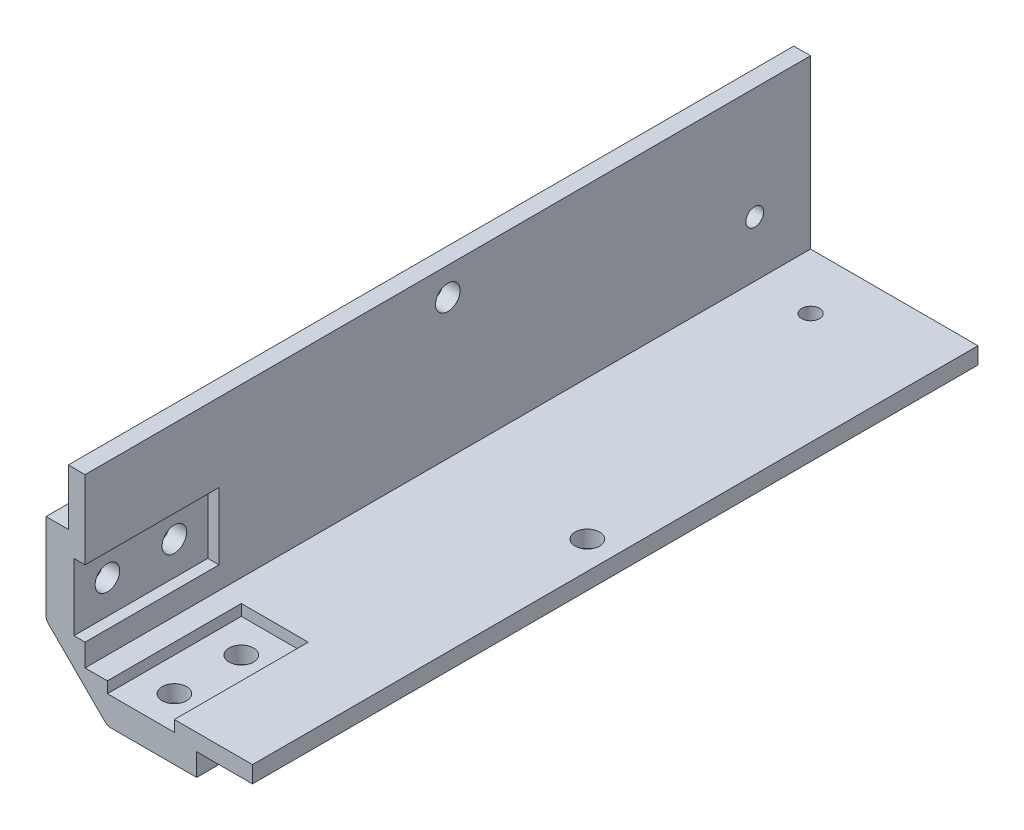
from build123d import *

# Parameters (mm, degrees)
BOSS_EXTRUDE1_DEPTH            = 130
FILLET1_R                      = 1.5
SKETCH2_W                      = 130
SKETCH2_H                      = 3
BOSS_EXTRUDE2_DEPTH            = 10
SKETCH4_W                      = 13
SKETCH4_H                      = 130
BOSS_EXTRUDE3_DEPTH            = 4
SKETCH6_W                      = 3
SKETCH6_H                      = 130
BOSS_EXTRUDE4_DEPTH            = 10
SKETCH5_W                      = 130
SKETCH5_H                      = 13
BOSS_EXTRUDE5_DEPTH            = 4
CSK_FOR_M3_SFHCS1_D            = 3.2
CSK_FOR_M3_SFHCS1_CSINK_D      = 6.72
CSK_FOR_M3_SFHCS1_CSINK_ANGLE  = 90
CSK_FOR_M3_SFHCS2_D            = 3.2
CSK_FOR_M3_SFHCS2_CSINK_D      = 6.72
CSK_FOR_M3_SFHCS2_CSINK_ANGLE  = 90
SKETCH13_W                     = 12
SKETCH13_H                     = 24
CUT_EXTRUDE1_DEPTH             = 2
F_4_4_4_4_DIAMETER_HOLE1_D     = 4.4
F_4_4_4_4_DIAMETER_HOLE1_DEPTH = 3
SKETCH16_W                     = 24
SKETCH16_H                     = 12
CUT_EXTRUDE2_DEPTH             = 2
F_4_4_4_4_DIAMETER_HOLE2_D     = 4.4
F_4_4_4_4_DIAMETER_HOLE2_DEPTH = 3
F_4_4_4_4_DIAMETER_HOLE3_D     = 4.4
F_4_4_4_4_DIAMETER_HOLE4_D     = 4.4


with BuildPart() as part:
    # Sketch1 → Boss-Extrude1 (new body)
    with BuildSketch(Plane.XY.offset(280)):
        Polygon((-7, 4), (4, -7), (7, -7), (7, -3), (20, -3), (20, 0), (0, 0), (0, 20), (-3, 20), (-3, 7), (-7, 7), align=None)
    extrude(amount=-BOSS_EXTRUDE1_DEPTH)

    # Fillet1
    fillet1_edges = [part.edges().sort_by_distance(p)[0] for p in [
        (4, -7, 215),
        (-7, 4, 215),
    ]]
    fillet(fillet1_edges, radius=FILLET1_R)

    # Sketch2 → Boss-Extrude2 (add)
    with BuildSketch(Plane(origin=(20, 0, 0), x_dir=(0, 0, -1), z_dir=(1, 0, 0))):
        with Locations((-215, -1.5)):
            Rectangle(SKETCH2_W, SKETCH2_H)
    extrude(amount=BOSS_EXTRUDE2_DEPTH)

    # Sketch4 → Boss-Extrude3 (add)
    with BuildSketch(Plane.XZ.offset(3)):
        with Locations((13.5, 215)):
            Rectangle(SKETCH4_W, SKETCH4_H)
    extrude(amount=BOSS_EXTRUDE3_DEPTH)

    # Sketch6 → Boss-Extrude4 (add)
    with BuildSketch(Plane(origin=(0, 20, 0), x_dir=(1, 0, 0), z_dir=(0, 1, 0))):
        with Locations((-1.5, -215)):
            Rectangle(SKETCH6_W, SKETCH6_H)
    extrude(amount=BOSS_EXTRUDE4_DEPTH)

    # Sketch5 → Boss-Extrude5 (add)
    with BuildSketch(Plane.ZY.offset(3)):
        with Locations((215, 13.5)):
            Rectangle(SKETCH5_W, SKETCH5_H)
    extrude(amount=BOSS_EXTRUDE5_DEPTH)

    # CSK for M3 SFHCS1 (through all)
    with Locations(Plane.ZY.offset(7)):
        with Locations((160, 10)):
            CounterSinkHole(CSK_FOR_M3_SFHCS1_D / 2, CSK_FOR_M3_SFHCS1_CSINK_D / 2, counter_sink_angle=CSK_FOR_M3_SFHCS1_CSINK_ANGLE)

    # CSK for M3 SFHCS2 (through all)
    with Locations(Plane.XZ.offset(7)):
        with Locations((10, 160)):
            CounterSinkHole(CSK_FOR_M3_SFHCS2_D / 2, CSK_FOR_M3_SFHCS2_CSINK_D / 2, counter_sink_angle=CSK_FOR_M3_SFHCS2_CSINK_ANGLE)

    # Sketch13 → Cut-Extrude1 (cut)
    with BuildSketch(Plane(origin=(0, 0, 0), x_dir=(1, 0, 0), z_dir=(0, 1, 0))):
        with Locations((10, -268)):
            Rectangle(SKETCH13_W, SKETCH13_H)
    extrude(amount=-CUT_EXTRUDE1_DEPTH, mode=Mode.SUBTRACT)

    # Ø4.4 (4.4) Diameter Hole1
    with Locations(Plane(origin=(0, -2, 0), x_dir=(1, 0, 0), z_dir=(0, 1, 0))):
        with Locations((10, -262), (10, -274)):
            Hole(F_4_4_4_4_DIAMETER_HOLE1_D / 2, depth=F_4_4_4_4_DIAMETER_HOLE1_DEPTH)

    # Sketch16 → Cut-Extrude2 (cut)
    with BuildSketch(Plane(origin=(0, 0, 0), x_dir=(0, 0, -1), z_dir=(1, 0, 0))):
        with Locations((-268, 10)):
            Rectangle(SKETCH16_W, SKETCH16_H)
    extrude(amount=-CUT_EXTRUDE2_DEPTH, mode=Mode.SUBTRACT)

    # Ø4.4 (4.4) Diameter Hole2
    with Locations(Plane(origin=(-2, 0, 0), x_dir=(0, 0, -1), z_dir=(1, 0, 0))):
        with Locations((-262, 10), (-274, 10)):
            Hole(F_4_4_4_4_DIAMETER_HOLE2_D / 2, depth=F_4_4_4_4_DIAMETER_HOLE2_DEPTH)

    # Ø4.4 (4.4) Diameter Hole3 (through all)
    with Locations(Plane.ZY.offset(3)):
        with Locations((215, 25)):
            Hole(F_4_4_4_4_DIAMETER_HOLE3_D / 2)

    # Ø4.4 (4.4) Diameter Hole4 (through all)
    with Locations(Plane.XZ.offset(3)):
        with Locations((25, 215)):
            Hole(F_4_4_4_4_DIAMETER_HOLE4_D / 2)


solid = part.part
